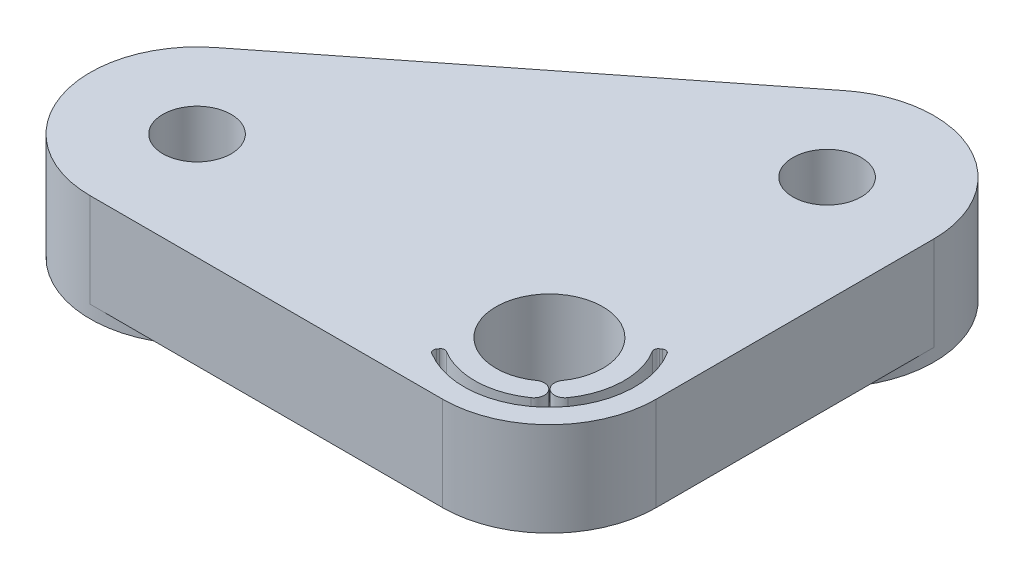
from build123d import *

# Parameters (mm, degrees)
SKETCH1_R           = 1.6
SKETCH1_R_2         = 2.5
BOSS_EXTRUDE1_DEPTH = 1.57
FILLET1_R           = 5
SKETCH2_R           = 2.5
SKETCH2_R_2         = 1.6
BOSS_EXTRUDE2_DEPTH = 2.83
SKETCH3_R           = 5
SKETCH3_R_2         = 1.6
BOSS_EXTRUDE3_DEPTH = 0.6
CUT_EXTRUDE1_START  = -10
CUT_EXTRUDE1_DEPTH  = 10


with BuildPart() as part:
    # Sketch1 → Boss-Extrude1 (new body)
    with BuildSketch(Plane(origin=(0, 0, 0), x_dir=(1, 0, 0), z_dir=(0, 1, 0))):
        Polygon((-5, -5), (30.925365976, -5), (-5, 23.304833799), align=None)
        with Locations(Location((16.5, 0, 0), (0, 0, 270))):
            Circle(SKETCH1_R, mode=Mode.SUBTRACT)
        with Locations(Location((0, 0, 0), (0, 0, 270))):
            Circle(SKETCH1_R_2, mode=Mode.SUBTRACT)
        with Locations(Location((0, 13, 0), (0, 0, 270))):
            Circle(SKETCH1_R, mode=Mode.SUBTRACT)
    extrude(amount=BOSS_EXTRUDE1_DEPTH)

    # Fillet1
    fillet1_edges = [part.edges().sort_by_distance(p)[0] for p in [
        (-5, 0.785, -23.304833799),
        (30.925365976, 0.785, 5),
        (-5, 0.785, 5),
    ]]
    fillet(fillet1_edges, radius=FILLET1_R)

    # Sketch2 → Boss-Extrude2 (add)
    with BuildSketch(Plane(origin=(0, 1.57, 0), x_dir=(1, 0, 0), z_dir=(0, 1, 0))):
        with BuildLine():
            Line((19.594361133, 3.927458361), (3.094361133, 16.927458361))
            ThreePointArc((3.094361133, 16.927458361), (-2.182681188, 17.498433375), (-5, 13))
            Line((-5, 13), (-5, 0))
            ThreePointArc((-5, 0), (-3.535533906, -3.535533906), (0, -5))
            Line((0, -5), (16.5, -5))
            ThreePointArc((16.5, -5), (21.224261413, -1.637484075), (19.594361133, 3.927458361))
        make_face()
        with Locations(Location((0, 0, 0), (0, 0, 270))):
            Circle(SKETCH2_R, mode=Mode.SUBTRACT)
        with Locations(Location((16.5, 0, 0), (0, 0, 270))):
            Circle(SKETCH2_R_2, mode=Mode.SUBTRACT)
        with Locations(Location((0, 13, 0), (0, 0, 270))):
            Circle(SKETCH2_R_2, mode=Mode.SUBTRACT)
    extrude(amount=BOSS_EXTRUDE2_DEPTH)

    # Sketch3 → Boss-Extrude3 (add)
    # profile 1 of 2: a face of its own
    with BuildSketch(Plane.XZ):
        with Locations(Location((16.5, 0, 0), (0, 0, 270))):
            Circle(SKETCH3_R)
        with Locations(Location((16.5, 0, 0), (0, 0, 270))):
            Circle(SKETCH3_R_2, mode=Mode.SUBTRACT)
    # profile 2 of 2: a face of its own
    with BuildSketch(Plane.XZ):
        with Locations(Location((0, -13, 0), (0, 0, 270))):
            Circle(SKETCH3_R)
        with Locations(Location((0, -13, 0), (0, 0, 270))):
            Circle(SKETCH3_R_2, mode=Mode.SUBTRACT)
    extrude(amount=BOSS_EXTRUDE3_DEPTH)

    # Sketch4 → Cut-Extrude1 (cut)
    with BuildSketch(Plane(origin=(0, 4.4, 0), x_dir=(1, 0, 0), z_dir=(0, 1, 0)).offset(CUT_EXTRUDE1_START)):
        with BuildLine():
            Line((2.119130133, -3.026431476), (2.176569541, -3.108463452))
            ThreePointArc((2.176569541, -3.108463452), (2.208718169, -3.263081334), (2.118672771, -3.392819725))
            ThreePointArc((2.118672771, -3.392819725), (-2.828427125, -2.828427125), (-3.392819725, 2.118672771))
            ThreePointArc((-3.392819725, 2.118672771), (-3.263081334, 2.208718169), (-3.108463452, 2.176569541))
            Line((-3.108463452, 2.176569541), (-3.026431476, 2.119130133))
            ThreePointArc((-3.026431476, 2.119130133), (-2.945196197, 1.995341896), (-2.971355046, 1.849607847))
            ThreePointArc((-2.971355046, 1.849607847), (-3.498720526, -0.094629188), (-2.867032155, -2.007517527))
            ThreePointArc((-2.867032155, -2.007517527), (-2.170667915, -2.130305331), (-2.047880111, -1.433941091))
            ThreePointArc((-2.047880111, -1.433941091), (-1.767766953, -1.767766953), (-1.433941091, -2.047880111))
            ThreePointArc((-1.433941091, -2.047880111), (-2.130305331, -2.170667915), (-2.007517527, -2.867032155))
            ThreePointArc((-2.007517527, -2.867032155), (-0.094629188, -3.498720526), (1.849607847, -2.971355046))
            ThreePointArc((1.849607847, -2.971355046), (1.995341896, -2.945196197), (2.119130133, -3.026431476))
        make_face()
    extrude(amount=CUT_EXTRUDE1_DEPTH, mode=Mode.SUBTRACT)


with BuildPart() as body_2:
    # Mirror1: mirrored copy
    add(part.part.mirror(Plane(origin=(-5, 1.57, -23.304833799), x_dir=(0, 0, 1), z_dir=(1, 0, 0))))


solid = body_2.part
